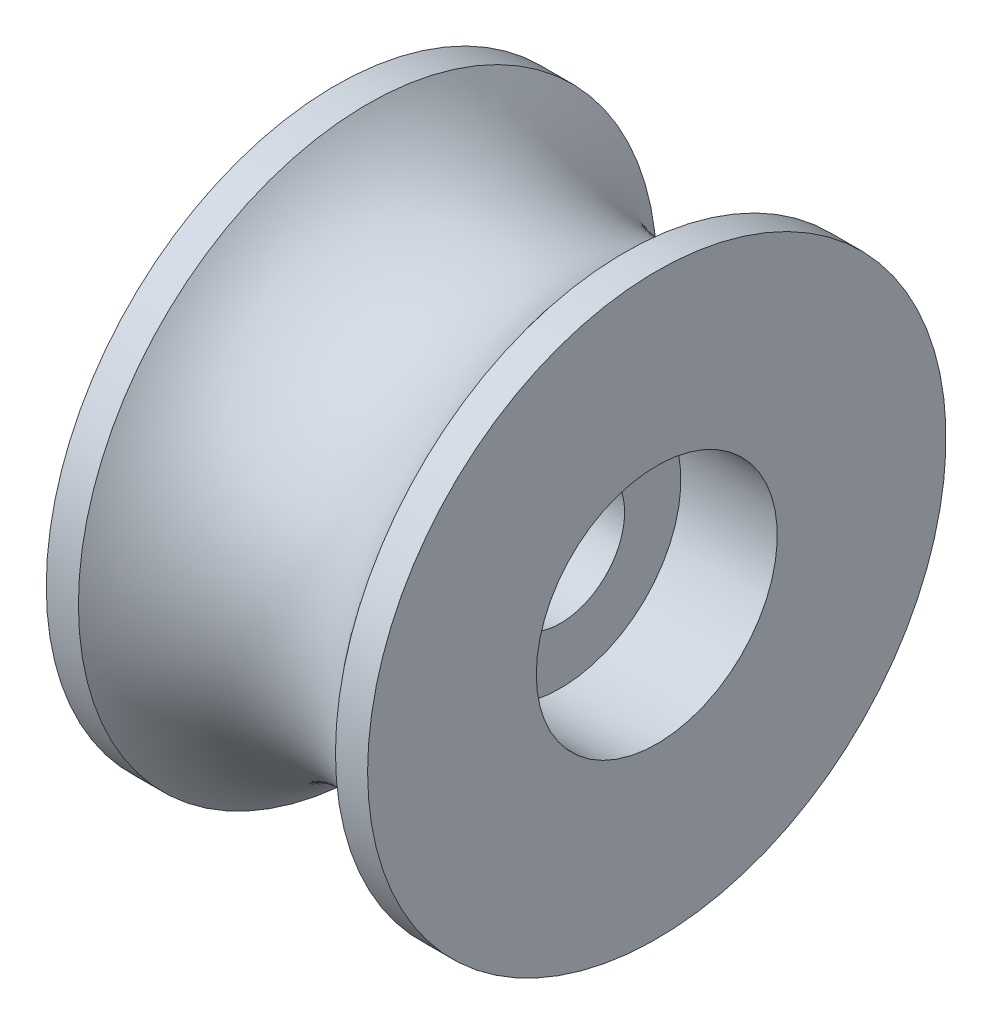
from build123d import *
from build123d.topology import SkipClean


with BuildPart() as part:
    # Sketch1 → Revolve1 (revolve)
    with BuildSketch(Plane.XY, mode=Mode.PRIVATE) as revolve1_sk:
        with BuildLine():
            Line((0, 2), (2, 2))
            Line((2, 2), (2, 3.75))
            Line((2, 3.75), (5, 3.75))
            Line((5, 3.75), (5, 9))
            Line((5, 9), (4, 9))
            ThreePointArc((4, 9), (2.236067977, 7.527864045), (0, 7))
            Line((0, 7), (0, 2))
        make_face()
    revolve1 = revolve(revolve1_sk.sketch.rotate(Axis((0, 0, 0), (1, 0, 0)), 90), axis=Axis((0, 0, 0), (1, 0, 0)))

    # Mirror1: Revolve1 across plane
    with SkipClean():  # the faces are left unmerged after this step: merging them gives an invalid solid
        add(revolve1.mirror(Plane(origin=(0, 2, 0), x_dir=(0, 0, 1), z_dir=(1, 0, 0))))


solid = part.part
